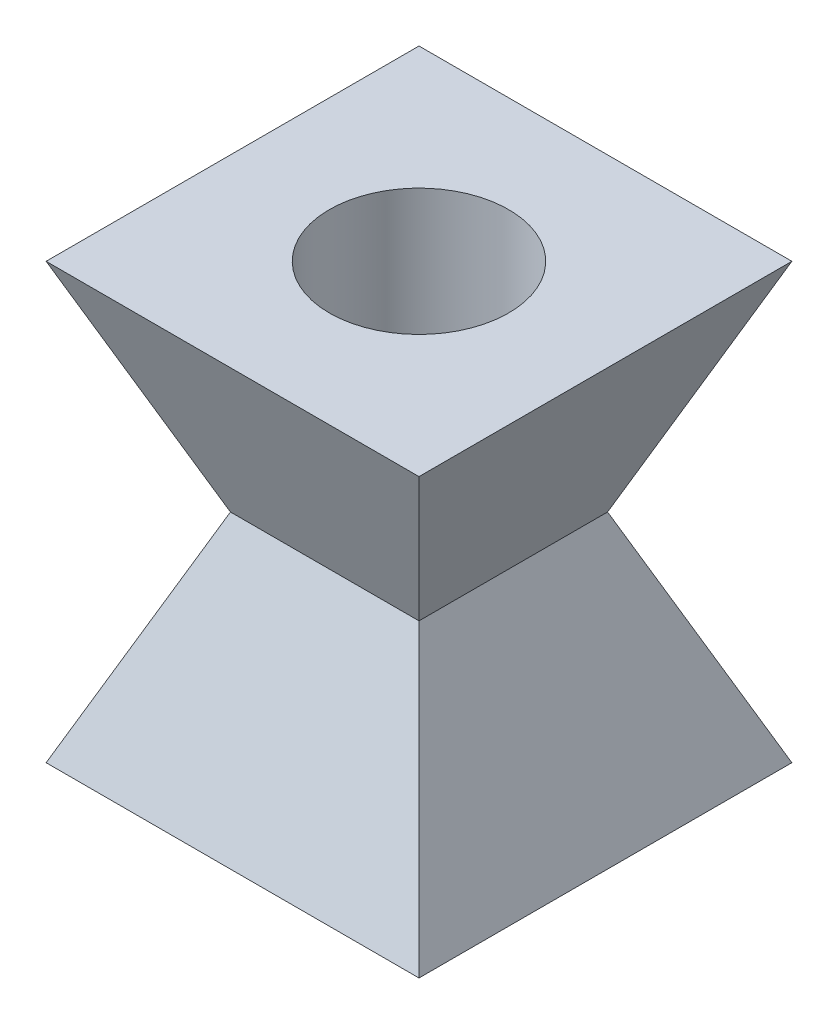
from build123d import *

# Parameters (mm, degrees)
SKETCH1_W           = 104
SKETCH1_H           = 121.112050925
BOSS_EXTRUDE1_DEPTH = 104
CUT_EXTRUDE1_DEPTH  = 104
CUT_EXTRUDE2_DEPTH  = 104
CUT_EXTRUDE3_DEPTH  = 191.525927053
CUT_EXTRUDE4_DEPTH  = 191.525927053
SKETCH6_R           = 25
CUT_EXTRUDE5_DEPTH  = 191.525927053


with BuildPart() as part:
    # Sketch1 → Boss-Extrude1 (new body)
    with BuildSketch(Plane.XY):
        with Locations((52, 60.556025463)):
            Rectangle(SKETCH1_W, SKETCH1_H)
    extrude(amount=BOSS_EXTRUDE1_DEPTH)

    # Sketch2 → Cut-Extrude1 (cut)
    with BuildSketch(Plane(origin=(0, 0, 0), x_dir=(-1, 0, 0), z_dir=(0, 0, -1))):
        Polygon((0, 121.112050925), (-25.704507779, 60.556025463), (0, 0), align=None)
    extrude(amount=-CUT_EXTRUDE1_DEPTH, mode=Mode.SUBTRACT)

    # Sketch3 → Cut-Extrude2 (cut)
    with BuildSketch(Plane(origin=(0, 0, 0), x_dir=(-1, 0, 0), z_dir=(0, 0, -1))):
        Polygon((-104, 121.112050925), (-78.295492221, 60.556025463), (-104, 0), align=None)
    extrude(amount=-CUT_EXTRUDE2_DEPTH, mode=Mode.SUBTRACT)

    # Sketch4 → Cut-Extrude3 (cut, through all)
    with BuildSketch(Plane(origin=(0, 0, 0), x_dir=(0, 0, -1), z_dir=(1, 0, 0))):
        Polygon((-104, 121.112050925), (-78.295492221, 60.556025463), (-104, 0), align=None)
    extrude(amount=CUT_EXTRUDE3_DEPTH, mode=Mode.SUBTRACT)

    # Sketch5 → Cut-Extrude4 (cut, through all)
    with BuildSketch(Plane(origin=(0, 0, 0), x_dir=(0, 0, -1), z_dir=(1, 0, 0))):
        Polygon((0, 121.112050925), (-25.704507779, 60.556025463), (0, 0), align=None)
    extrude(amount=CUT_EXTRUDE4_DEPTH, mode=Mode.SUBTRACT)

    # Sketch6 → Cut-Extrude5 (cut, through all)
    with BuildSketch(Plane(origin=(0, 121.112050925, 0), x_dir=(1, 0, 0), z_dir=(0, 1, 0))):
        with Locations(Location((52, -52, 0), (0, 0, 270))):
            Circle(SKETCH6_R)
    extrude(amount=-CUT_EXTRUDE5_DEPTH, mode=Mode.SUBTRACT)


solid = part.part
